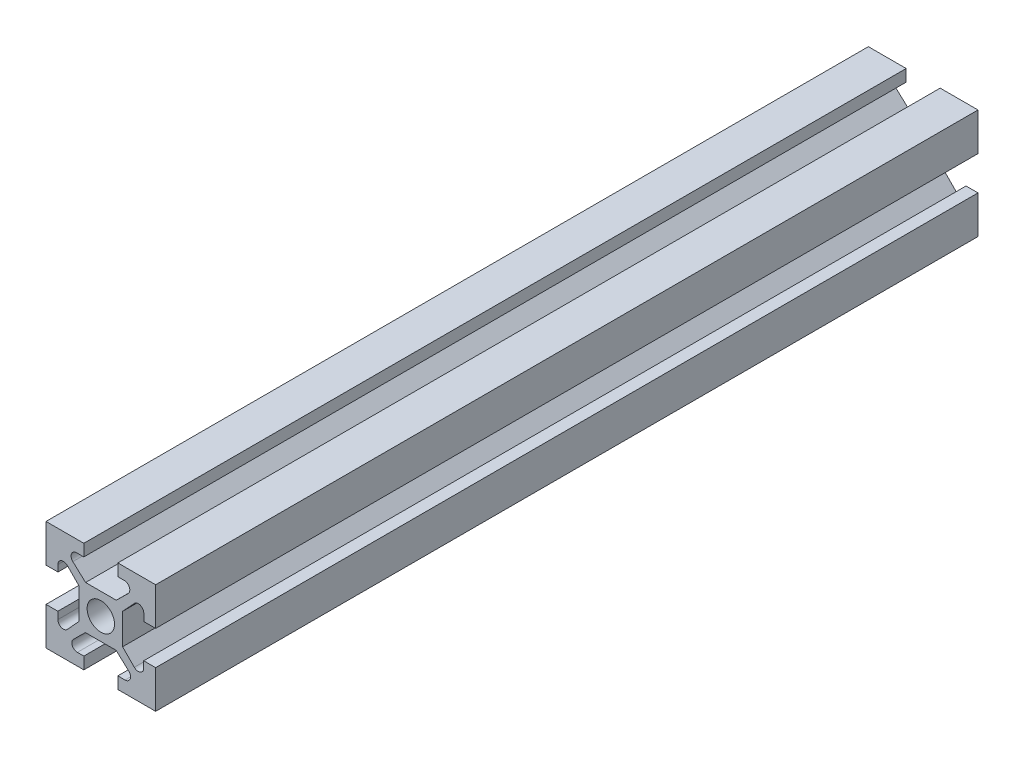
from build123d import *

# Parameters (mm, degrees)
SKETCH2_R           = 2.5
BOSS_EXTRUDE1_DEPTH = 150


with BuildPart() as part:
    # Sketch2 → Boss-Extrude1 (new body)
    with BuildSketch(Plane.XY):
        with BuildLine():
            Line((-10, -10), (-3.1, -10))
            Line((-3.1, -10), (-3.1, -7.81857447))
            Line((-3.1, -7.81857447), (-4.285374034, -7.81857447))
            ThreePointArc((-4.285374034, -7.81857447), (-5.210402021, -7.198473435), (-4.988208383, -6.107220917))
            Line((-4.988208383, -6.107220917), (-2.819718275, -3.96470075))
            Line((-2.819718275, -3.96470075), (0, -3.96470075))
            Line((0, -3.96470075), (2.782738033, -3.96470075))
            Line((2.782738033, -3.96470075), (5.105242131, -6.103332486))
            ThreePointArc((5.105242131, -6.103332486), (5.359419929, -7.202533996), (4.427854938, -7.838959152))
            Line((4.427854938, -7.838959152), (3.1, -7.838959152))
            Line((3.1, -7.838959152), (3.1, -10))
            Line((3.1, -10), (10, -10))
            Line((10, -10), (10, -3.1))
            Line((10, -3.1), (7.81857447, -3.1))
            Line((7.81857447, -3.1), (7.81857447, -4.285374034))
            ThreePointArc((7.81857447, -4.285374034), (7.198473435, -5.210402021), (6.107220917, -4.988208383))
            Line((6.107220917, -4.988208383), (3.96470075, -2.819718275))
            Line((3.96470075, -2.819718275), (3.96470075, 0))
            Line((3.96470075, 0), (3.96470075, 2.782738033))
            Line((3.96470075, 2.782738033), (6.103332486, 5.105242131))
            ThreePointArc((6.103332486, 5.105242131), (7.202533996, 5.359419929), (7.838959152, 4.427854938))
            Line((7.838959152, 4.427854938), (7.838959152, 3.1))
            Line((7.838959152, 3.1), (10, 3.1))
            Line((10, 3.1), (10, 10))
            Line((10, 10), (3.1, 10))
            Line((3.1, 10), (3.1, 7.81857447))
            Line((3.1, 7.81857447), (4.285374034, 7.81857447))
            ThreePointArc((4.285374034, 7.81857447), (5.210402021, 7.198473435), (4.988208383, 6.107220917))
            Line((4.988208383, 6.107220917), (2.819718275, 3.96470075))
            Line((2.819718275, 3.96470075), (0, 3.96470075))
            Line((0, 3.96470075), (-2.782738033, 3.96470075))
            Line((-2.782738033, 3.96470075), (-5.105242131, 6.103332486))
            ThreePointArc((-5.105242131, 6.103332486), (-5.359419929, 7.202533996), (-4.427854938, 7.838959152))
            Line((-4.427854938, 7.838959152), (-3.1, 7.838959152))
            Line((-3.1, 7.838959152), (-3.1, 10))
            Line((-3.1, 10), (-10, 10))
            Line((-10, 10), (-10, 3.1))
            Line((-10, 3.1), (-7.81857447, 3.1))
            Line((-7.81857447, 3.1), (-7.81857447, 4.285374034))
            ThreePointArc((-7.81857447, 4.285374034), (-7.198473435, 5.210402021), (-6.107220917, 4.988208383))
            Line((-6.107220917, 4.988208383), (-3.96470075, 2.819718275))
            Line((-3.96470075, 2.819718275), (-3.96470075, 0))
            Line((-3.96470075, 0), (-3.96470075, -2.782738033))
            Line((-3.96470075, -2.782738033), (-6.103332486, -5.105242131))
            ThreePointArc((-6.103332486, -5.105242131), (-7.202533996, -5.359419929), (-7.838959152, -4.427854938))
            Line((-7.838959152, -4.427854938), (-7.838959152, -3.1))
            Line((-7.838959152, -3.1), (-10, -3.1))
            Line((-10, -3.1), (-10, -10))
        make_face()
        Circle(SKETCH2_R, mode=Mode.SUBTRACT)
    extrude(amount=BOSS_EXTRUDE1_DEPTH)


solid = part.part
